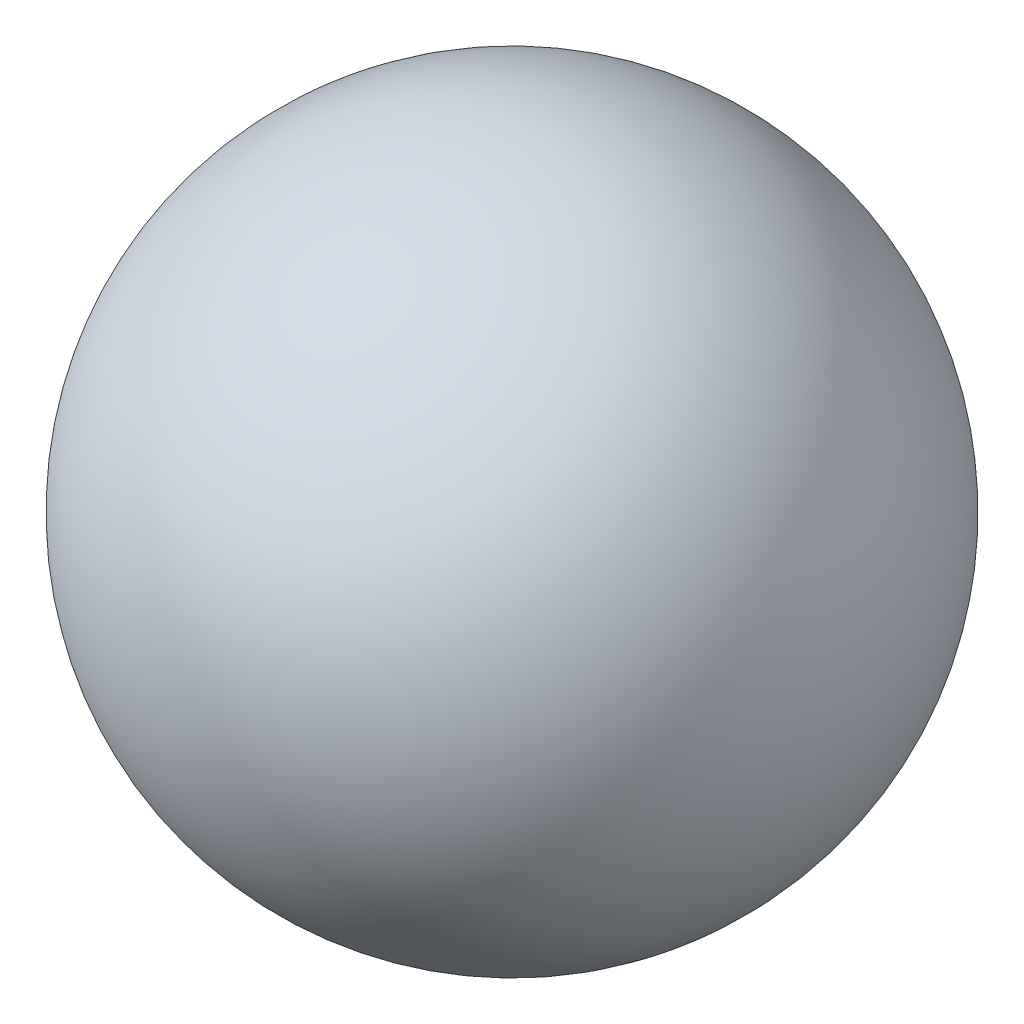
from build123d import *


with BuildPart() as part:
    # Sketch1 → Revolve1 (revolve)
    with BuildSketch(Plane.XY):
        with BuildLine():
            Line((1.604994878, -2.779932675), (2.363755122, -4.094143968))
            ThreePointArc((2.363755122, -4.094143968), (2.641480646, -3.0576582), (1.604994878, -2.779932675))
        make_face()
    revolve(axis=Axis((1.845512238, -3.196520962, 0), (0.4999999999999946, -0.8660254037844417, 0)))


solid = part.part
